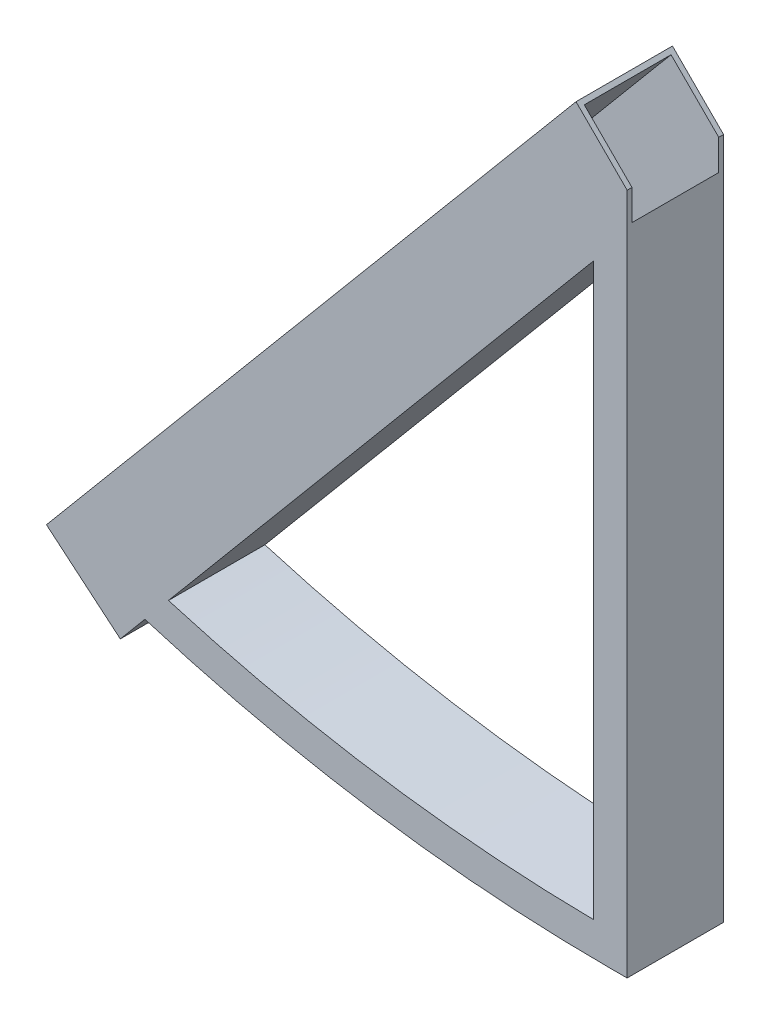
from build123d import *

# Parameters (mm, degrees)
BOSS_EXTRUDE1_DEPTH      = 10
BOSS_EXTRUDE1_DEPTH_BACK = 10
CUT_EXTRUDE1_DEPTH       = 213.726165923
CUT_EXTRUDE1_DEPTH_BACK  = 213.726165923
SKETCH2_W                = 18
SKETCH2_H                = 18


with BuildPart() as part:
    # Sketch1 → Boss-Extrude1 (new, two sides: drawn at the far end of the back side and taken through both)
    with BuildSketch(Plane.XY.offset(-BOSS_EXTRUDE1_DEPTH_BACK)):
        with BuildLine():
            Line((-7.098078142, 152.098078142), (-116.934338078, 21.200320767))
            Line((-116.934338078, 21.200320767), (-101.613449216, 8.344568573))
            Line((-101.613449216, 8.344568573), (-96.5092206, 14.427551362))
            ThreePointArc((-96.5092206, 14.427551362), (-48.790839046, 3.626817852), (0, 0))
            Line((0, 0), (3.5, 0))
            Line((3.5, 0), (3.5, 141.5))
            Line((3.5, 141.5), (-7.098078142, 152.098078142))
        make_face()
        with BuildLine():
            Line((-3.5, 7), (-3.5, 125.271624157))
            Line((-3.5, 125.271624157), (-91.625019277, 20.248315836))
            ThreePointArc((-91.625019277, 20.248315836), (-48.02157631, 10.570542672), (-3.5, 7))
        make_face(mode=Mode.SUBTRACT)
    extrude(amount=BOSS_EXTRUDE1_DEPTH + BOSS_EXTRUDE1_DEPTH_BACK)

    # Sketch2 → Cut-Extrude1 (cut, two sides: drawn at the far end of the back side and taken through both)
    with BuildSketch(Plane(origin=(-37.875331553, -45.138062449, 0), x_dir=(-0.7660444431189823, 0.6427876096865343, 0), z_dir=(-0.6427876096865343, -0.7660444431189825, 0)).offset(-CUT_EXTRUDE1_DEPTH_BACK)):
        with Locations((93.204203405, 0)):
            Rectangle(SKETCH2_W, SKETCH2_H)
    extrude(amount=CUT_EXTRUDE1_DEPTH + CUT_EXTRUDE1_DEPTH_BACK, mode=Mode.SUBTRACT)


solid = part.part
